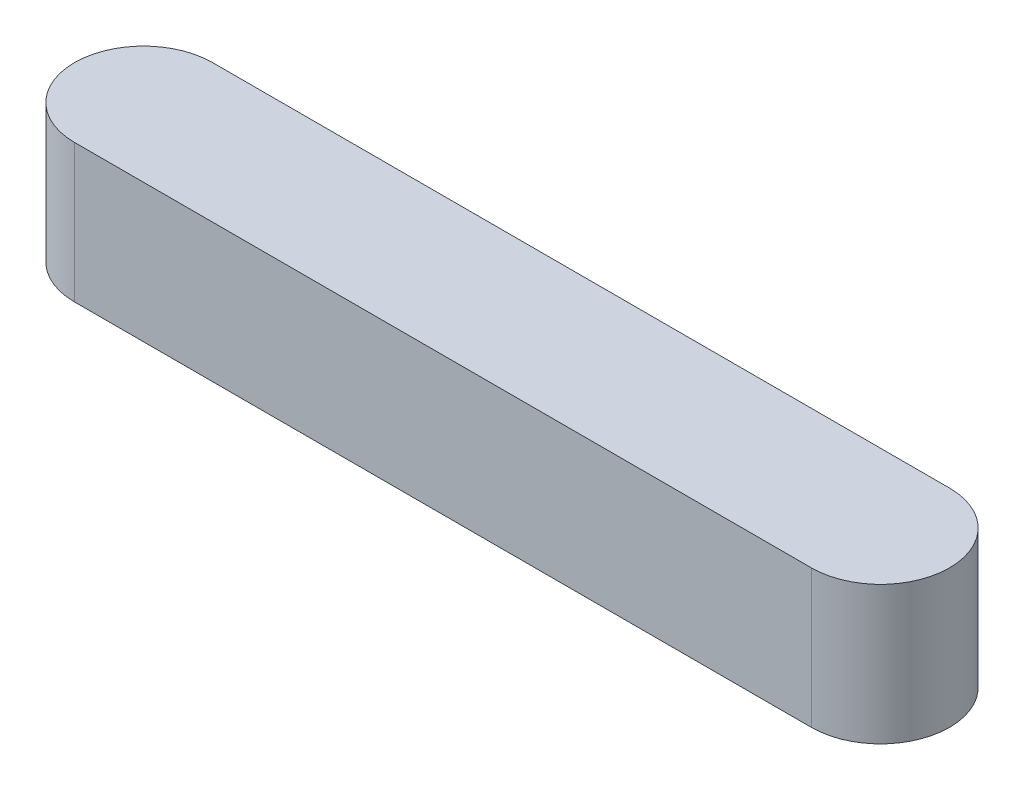
from build123d import *

# Parameters (mm, degrees)
BOSS_EXTRUDE1_DEPTH = 3


with BuildPart() as part:
    # Sketch1 → Boss-Extrude1 (new body)
    with BuildSketch(Plane(origin=(0, 0, 0), x_dir=(1, 0, 0), z_dir=(0, 1, 0))):
        with BuildLine():
            Line((-8, 1.5), (8, 1.5))
            ThreePointArc((8, 1.5), (9.5, 0), (8, -1.5))
            Line((8, -1.5), (-8, -1.5))
            ThreePointArc((-8, -1.5), (-9.5, 0), (-8, 1.5))
        make_face()
    extrude(amount=BOSS_EXTRUDE1_DEPTH)


solid = part.part
